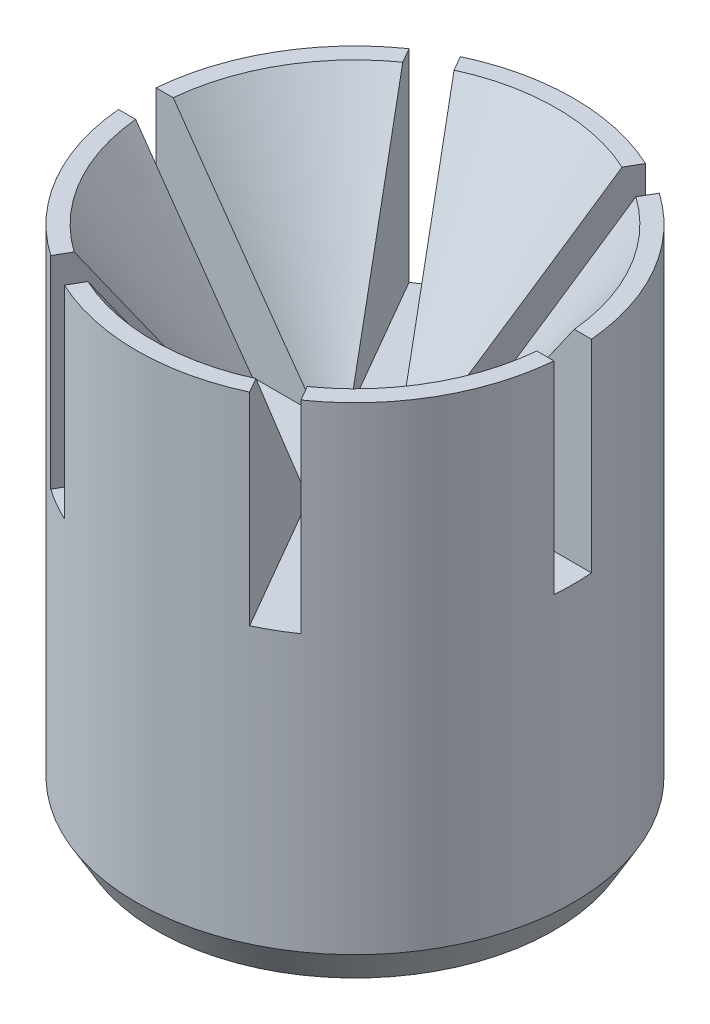
from build123d import *

# Parameters (mm, degrees)
CHAMFER1_SIZE      = 1
CHAMFER1_SIZE2     = 0.577350269
SKETCH2_W          = 6.4
SKETCH2_H          = 5.926814228
CUT_EXTRUDE1_DEPTH = 0.55
CIRPATTERN1_COUNT  = 6


with BuildPart() as part:
    # Sketch1 → Revolve1 (revolve)
    with BuildSketch(Plane.XY, mode=Mode.PRIVATE) as revolve1_sk:
        Polygon((0, 0), (0, 0.5), (0.75, 0.5), (0.75, 5.073185772), (1.75, 5.073185772), (5.9, 11), (6.4, 11), (6.4, -4), (2.7, -4), (2.7, 0), align=None)
    revolve(revolve1_sk.sketch.rotate(Axis((0, 0, 0), (0, 1, 0)), 90), axis=Axis((0, 0, 0), (0, 1, 0)))

    # Chamfer1
    chamfer1_edges = [part.edges().sort_by_distance(p)[0] for p in [
        (0, -4, 6.4),
    ]]
    chamfer1_side = [part.faces().sort_by_distance(p)[0] for p in [
        (0, 3.5, 6.4),
    ]]
    chamfer(chamfer1_edges, length=CHAMFER1_SIZE, length2=CHAMFER1_SIZE2, reference=chamfer1_side[0])

    # Sketch2 → Cut-Extrude1 (cut, symmetric)
    with BuildSketch(Plane(origin=(0, 0, 0), x_dir=(-1, 0, 0), z_dir=(0, 0, -1))):
        with Locations((-3.2, 8.036592886)):
            Rectangle(SKETCH2_W, SKETCH2_H)
    cut_extrude1 = extrude(amount=CUT_EXTRUDE1_DEPTH, both=True, mode=Mode.SUBTRACT)

    # CirPattern1: Cut-Extrude1 ×6 about axis
    cirpattern1_axis = Axis((0, 0, 0), (0, 1, 0))
    for i in range(1, CIRPATTERN1_COUNT):
        add(cut_extrude1.rotate(cirpattern1_axis, i * 360 / CIRPATTERN1_COUNT), mode=Mode.SUBTRACT)


solid = part.part
